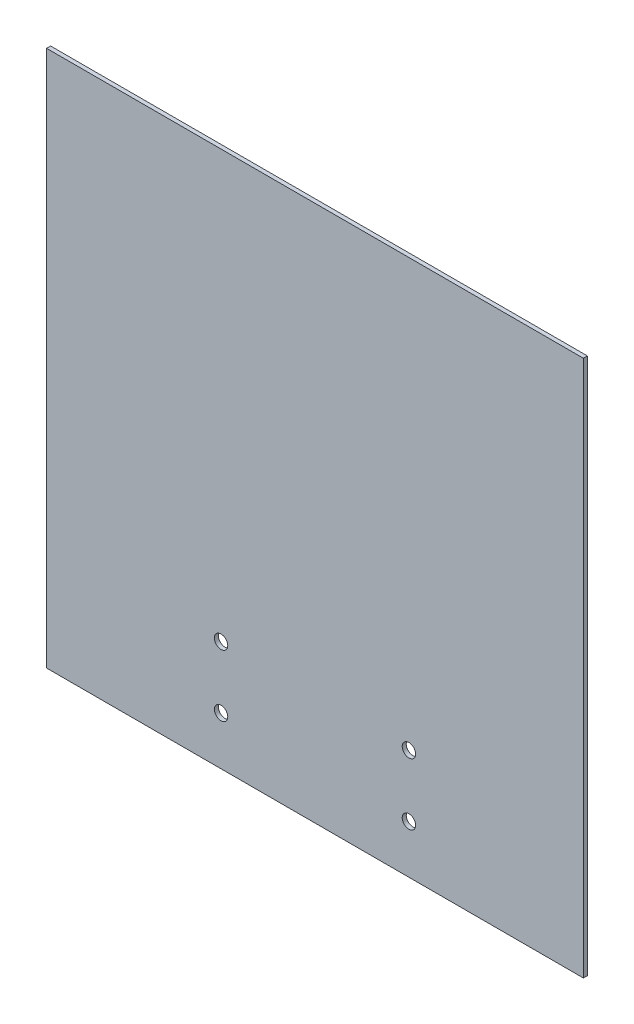
from build123d import *

# Parameters (mm, degrees)
SKETCH_1_W          = 200
SKETCH_1_H          = 200
EXTRUDE_1_DEPTH     = 1.5
SKETCH_2_R          = 2.5
CUT_EXTRUDE_1_DEPTH = 1.5


with BuildPart() as part:
    # 草图1 → 凸台-拉伸1 (new body)
    with BuildSketch(Plane.XY):
        Rectangle(SKETCH_1_W, SKETCH_1_H)
    extrude(amount=EXTRUDE_1_DEPTH)

    # 草图2 → 切除-拉伸1 (cut)
    with BuildSketch(Plane.XY.offset(1.5)):
        with Locations((-35, -82)):
            Circle(SKETCH_2_R)
        with Locations((-35, -59)):
            Circle(SKETCH_2_R)
        with Locations(Location((35, -82, 0), (0, 0, 180))):
            Circle(SKETCH_2_R)
        with Locations(Location((35, -59, 0), (0, 0, 180))):
            Circle(SKETCH_2_R)
    extrude(amount=-CUT_EXTRUDE_1_DEPTH, mode=Mode.SUBTRACT)


solid = part.part
